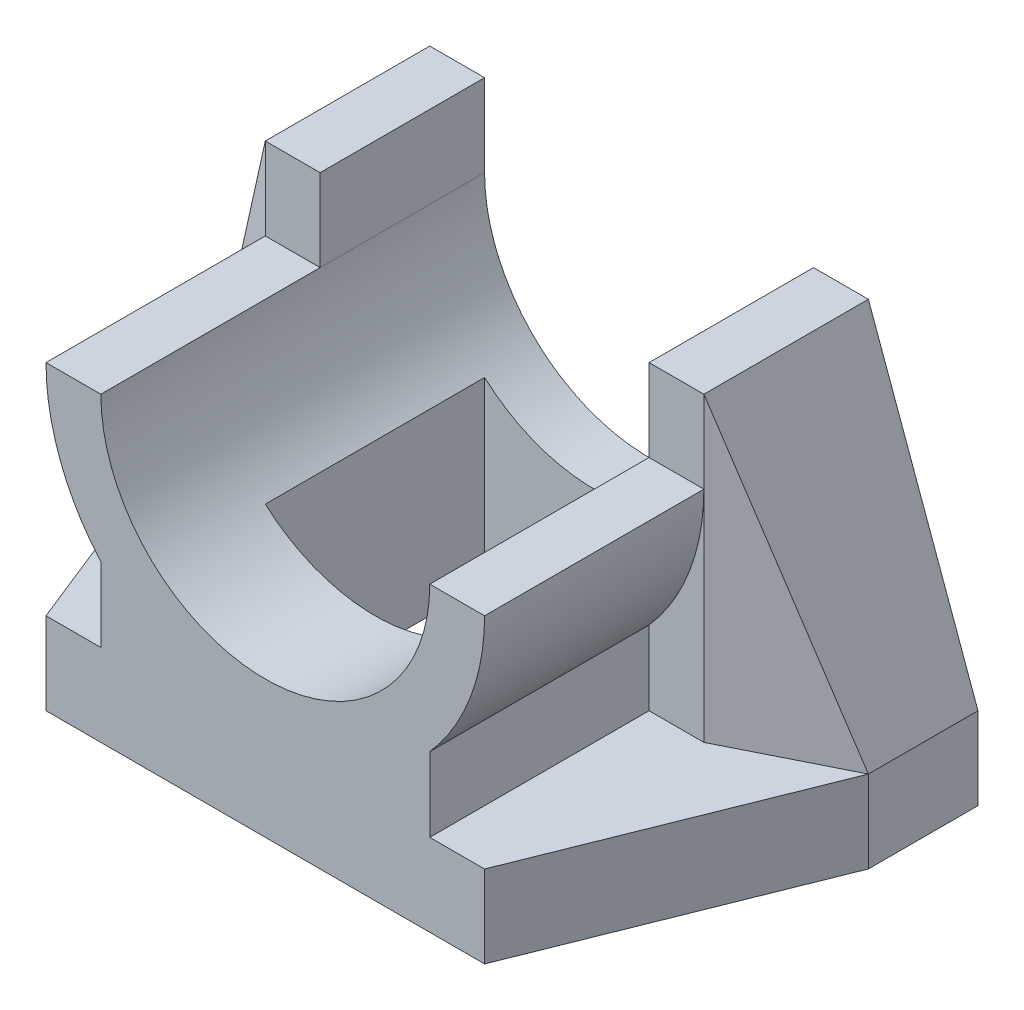
from build123d import *

# Parameters (mm, degrees)
SKETCH1_W               = 80
SKETCH1_H               = 70
BOSS_EXTRUDE1_DEPTH     = 15
BOSS_EXTRUDE2_DEPTH     = 70
SKETCH3_W               = 20
SKETCH3_H               = 70
BOSS_EXTRUDE3_DEPTH     = 15
SKETCH4_W               = 10
SKETCH4_H               = 15
BOSS_EXTRUDE4_DEPTH     = 30
BOSS_EXTRUDE5_DEPTH     = 30
CUT_EXTRUDE1_DEPTH      = 15
CUT_EXTRUDE2_START      = 15
CUT_EXTRUDE2_DEPTH      = 60
CUT_EXTRUDE3_DEPTH      = 116.758369028
CUT_EXTRUDE3_DEPTH_BACK = 116.758369028
CUT_EXTRUDE4_DEPTH      = 116.758369028
CUT_EXTRUDE4_DEPTH_BACK = 116.758369028
SKETCH9_W               = 40
SKETCH9_H               = 40


with BuildPart() as part:
    # Sketch1 → Boss-Extrude1 (new body)
    with BuildSketch(Plane(origin=(0, 0, 0), x_dir=(1, 0, 0), z_dir=(0, 1, 0))):
        with Locations((0, -35)):
            Rectangle(SKETCH1_W, SKETCH1_H)
    extrude(amount=BOSS_EXTRUDE1_DEPTH)

    # Sketch2 → Boss-Extrude2 (add)
    with BuildSketch(Plane.XY):
        with BuildLine():
            Line((-30, 15), (30, 15))
            Line((30, 15), (30, 28.542486889))
            ThreePointArc((30, 28.542486889), (37.416573868, 40.857864376), (40, 55))
            Line((40, 55), (-40, 55))
            ThreePointArc((-40, 55), (-37.416573868, 40.857864376), (-30, 28.542486889))
            Line((-30, 28.542486889), (-30, 15))
        make_face()
    extrude(amount=BOSS_EXTRUDE2_DEPTH)

    # Sketch3 → Boss-Extrude3 (add)
    with BuildSketch(Plane(origin=(0, 0, 0), x_dir=(1, 0, 0), z_dir=(0, 1, 0))):
        with Locations((-50, -35)):
            Rectangle(SKETCH3_W, SKETCH3_H)
    boss_extrude3 = extrude(amount=BOSS_EXTRUDE3_DEPTH)

    # Sketch4 → Boss-Extrude4 (add)
    with BuildSketch(Plane.XY):
        with Locations((-35, 62.5)):
            Rectangle(SKETCH4_W, SKETCH4_H)
    boss_extrude4 = extrude(amount=BOSS_EXTRUDE4_DEPTH)

    # Sketch5 → Boss-Extrude5 (add)
    with BuildSketch(Plane.XY):
        Polygon((-60, 15), (-40, 70), (-40, 55), (-30, 55), (-30, 15), align=None)
    boss_extrude5 = extrude(amount=BOSS_EXTRUDE5_DEPTH)

    # Sketch6 → Cut-Extrude1 (cut)
    with BuildSketch(Plane(origin=(0, 0, 0), x_dir=(1, 0, 0), z_dir=(0, 1, 0))):
        Polygon((-60, -20), (-40, -70), (-60, -70), align=None)
    cut_extrude1 = extrude(amount=CUT_EXTRUDE1_DEPTH, mode=Mode.SUBTRACT)

    # Sketch7 → Cut-Extrude2 (cut)
    with BuildSketch(Plane(origin=(0, 0, 0), x_dir=(1, 0, 0), z_dir=(0, 1, 0)).offset(CUT_EXTRUDE2_START)):
        Polygon((-60, -20), (-40, -30), (-60, -30), align=None)
    cut_extrude2 = extrude(amount=CUT_EXTRUDE2_DEPTH, mode=Mode.SUBTRACT)

    # Mirror1: Boss-Extrude3, Boss-Extrude4, Boss-Extrude5, Cut-Extrude1, Cut-Extrude2 across plane
    add(boss_extrude3.mirror(Plane(origin=(0, 0, 0), x_dir=(0, 0, 1), z_dir=(1, 0, 0))))
    add(boss_extrude4.mirror(Plane(origin=(0, 0, 0), x_dir=(0, 0, 1), z_dir=(1, 0, 0))))
    add(boss_extrude5.mirror(Plane(origin=(0, 0, 0), x_dir=(0, 0, 1), z_dir=(1, 0, 0))))
    add(cut_extrude1.mirror(Plane(origin=(0, 0, 0), x_dir=(0, 0, 1), z_dir=(1, 0, 0))), mode=Mode.SUBTRACT)
    add(cut_extrude2.mirror(Plane(origin=(0, 0, 0), x_dir=(0, 0, 1), z_dir=(1, 0, 0))), mode=Mode.SUBTRACT)

    # Sketch8 → Cut-Extrude3 (cut, two sides: drawn at the far end of the back side and taken through both)
    with BuildSketch(Plane.XY.offset(-CUT_EXTRUDE3_DEPTH_BACK)):
        with BuildLine():
            Line((-30, 72), (-30, 55))
            ThreePointArc((-30, 55), (0, 25), (30, 55))
            Line((30, 55), (30, 72))
            Line((30, 72), (-30, 72))
        make_face()
    extrude(amount=CUT_EXTRUDE3_DEPTH + CUT_EXTRUDE3_DEPTH_BACK, mode=Mode.SUBTRACT)

    # Sketch9 → Cut-Extrude4 (cut, two sides: drawn at the far end of the back side and taken through both)
    with BuildSketch(Plane(origin=(0, 0, 0), x_dir=(1, 0, 0), z_dir=(0, 1, 0)).offset(-CUT_EXTRUDE4_DEPTH_BACK)):
        with Locations((0, -30)):
            Rectangle(SKETCH9_W, SKETCH9_H)
    extrude(amount=CUT_EXTRUDE4_DEPTH + CUT_EXTRUDE4_DEPTH_BACK, mode=Mode.SUBTRACT)


solid = part.part
